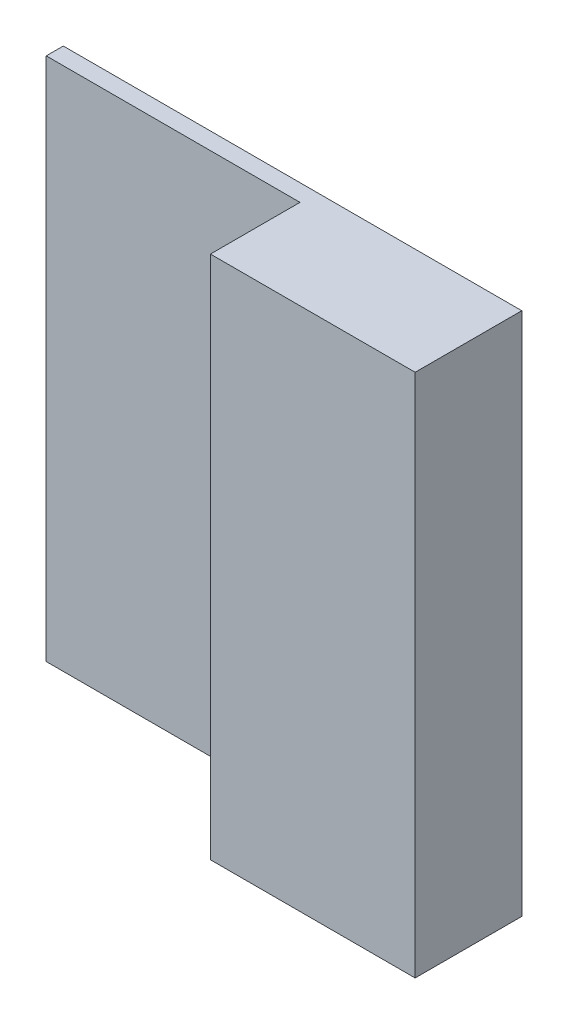
from build123d import *

# Parameters (mm, degrees)
SKETCH1_W           = 59.5
SKETCH1_H           = 4
SKETCH1_W_2         = 4
SKETCH1_W_3         = 44
BOSS_EXTRUDE1_DEPTH = 123


with BuildPart() as part:
    # Sketch1 → Boss-Extrude1 (new body)
    with BuildSketch(Plane(origin=(0, 0, 0), x_dir=(1, 0, 0), z_dir=(0, 1, 0))):
        with Locations((-77.75, 23)):
            Rectangle(SKETCH1_W, SKETCH1_H)
        with Locations((-46, 23)):
            Rectangle(SKETCH1_W_2, SKETCH1_H)
        Polygon((-48, 0), (-44, 0), (-44, 4), (-44, 21), (-48, 21), align=None)
        with Locations((-22, 2)):
            Rectangle(SKETCH1_W_3, SKETCH1_H)
        Polygon((-44, 4), (0, 4), (0, 25), (-44, 25), (-44, 21), align=None)
    extrude(amount=BOSS_EXTRUDE1_DEPTH)


solid = part.part
